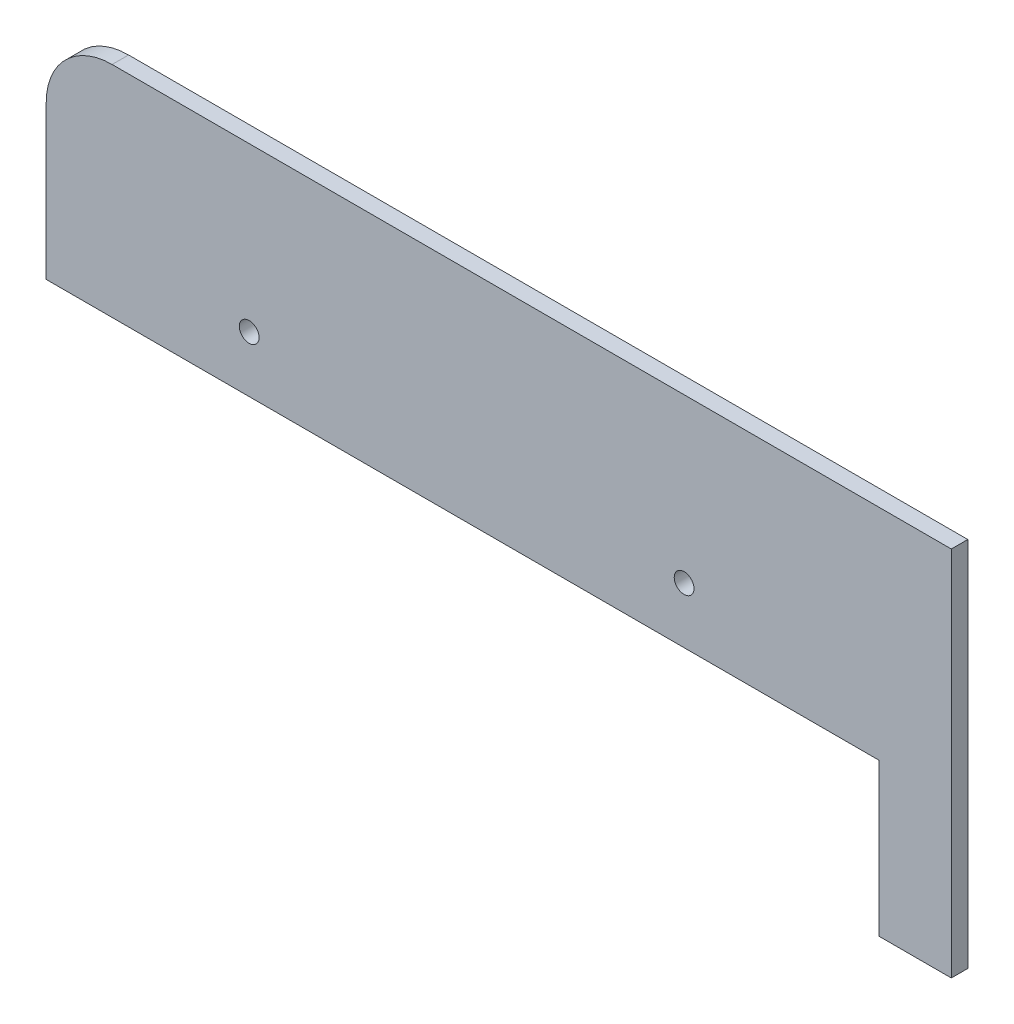
from build123d import *

# Parameters (mm, degrees)
BOSS_EXTRUDE1_DEPTH = 2.5
SKETCH2_R           = 1.5
CUT_EXTRUDE1_DEPTH  = 10
SKETCH3_W           = 124.34
SKETCH3_H           = 2.5
CUT_EXTRUDE2_DEPTH  = 1
SKETCH4_W           = 2.5
SKETCH4_H           = 33.25
BOSS_EXTRUDE2_DEPTH = 2
FILLET2_R           = 10


with BuildPart() as part:
    # Sketch1 → Boss-Extrude1 (new body)
    with BuildSketch(Plane.XY):
        Polygon((-67.40224359, 38.860576923), (-67.40224359, 4.610576923), (56.93775641, 4.610576923), (56.93775641, -17.519423077), (67.94775641, -17.519423077), (67.94775641, 38.860576923), align=None)
    extrude(amount=BOSS_EXTRUDE1_DEPTH)

    # Sketch2 → Cut-Extrude1 (cut)
    with BuildSketch(Plane(origin=(0, 0, 0), x_dir=(-1, 0, 0), z_dir=(0, 0, -1))):
        with Locations((-27.399068165, 14.110576923)):
            Circle(SKETCH2_R)
        with Locations((38.600931835, 14.110576923)):
            Circle(SKETCH2_R)
    extrude(amount=-CUT_EXTRUDE1_DEPTH, mode=Mode.SUBTRACT)

    # Sketch3 → Cut-Extrude2 (cut)
    with BuildSketch(Plane.XZ.offset(-4.610576923)):
        with Locations((-5.23224359, 1.25)):
            Rectangle(SKETCH3_W, SKETCH3_H)
    extrude(amount=-CUT_EXTRUDE2_DEPTH, mode=Mode.SUBTRACT)

    # Sketch4 → Boss-Extrude2 (add)
    with BuildSketch(Plane.ZY.offset(67.40224359)):
        with Locations((1.25, 22.235576923)):
            Rectangle(SKETCH4_W, SKETCH4_H)
    extrude(amount=BOSS_EXTRUDE2_DEPTH)

    # Fillet2
    fillet2_edges = [part.edges().sort_by_distance(p)[0] for p in [
        (-69.40224359, 38.860576923, 1.25),
    ]]
    fillet(fillet2_edges, radius=FILLET2_R)


solid = part.part
